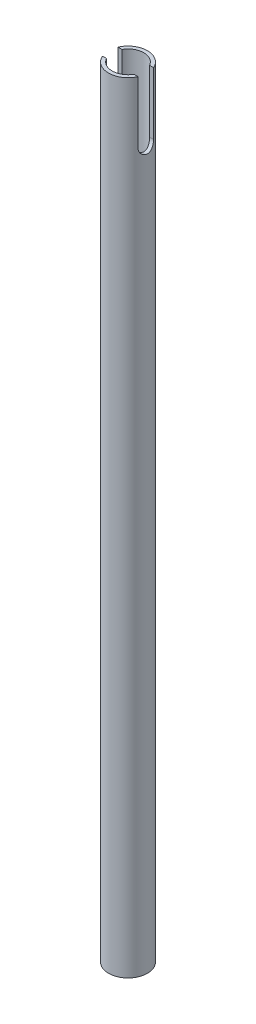
from build123d import *

# Parameters (mm, degrees)
SKETCH1_R               = 7.9375
SKETCH1_R_2             = 6.4643
BOSS_EXTRUDE1_DEPTH     = 318.547702053
CUT_EXTRUDE1_DEPTH      = 319.745425529
CUT_EXTRUDE1_DEPTH_BACK = 319.745425529


with BuildPart() as part:
    # Sketch1 → Boss-Extrude1 (new body)
    with BuildSketch(Plane(origin=(0, 0, 0), x_dir=(1, 0, 0), z_dir=(0, 1, 0))):
        with Locations(Location((0, 0, 0), (0, 0, 180))):
            Circle(SKETCH1_R)
        with Locations(Location((0, 0, 0), (0, 0, 180))):
            Circle(SKETCH1_R_2, mode=Mode.SUBTRACT)
    extrude(amount=BOSS_EXTRUDE1_DEPTH)

    # Sketch4 → Cut-Extrude1 (cut, two sides: drawn at the far end of the back side and taken through both)
    with BuildSketch(Plane(origin=(0, 0, 0), x_dir=(0, 0, -1), z_dir=(1, 0, 0)).offset(-CUT_EXTRUDE1_DEPTH_BACK)):
        with BuildLine():
            Line((3.175, 343.947702053), (3.175, 293.147702053))
            ThreePointArc((3.175, 293.147702053), (0, 289.972702053), (-3.175, 293.147702053))
            Line((-3.175, 293.147702053), (-3.175, 343.947702053))
            ThreePointArc((-3.175, 343.947702053), (0, 347.122702053), (3.175, 343.947702053))
        make_face()
    extrude(amount=CUT_EXTRUDE1_DEPTH + CUT_EXTRUDE1_DEPTH_BACK, mode=Mode.SUBTRACT)


solid = part.part
